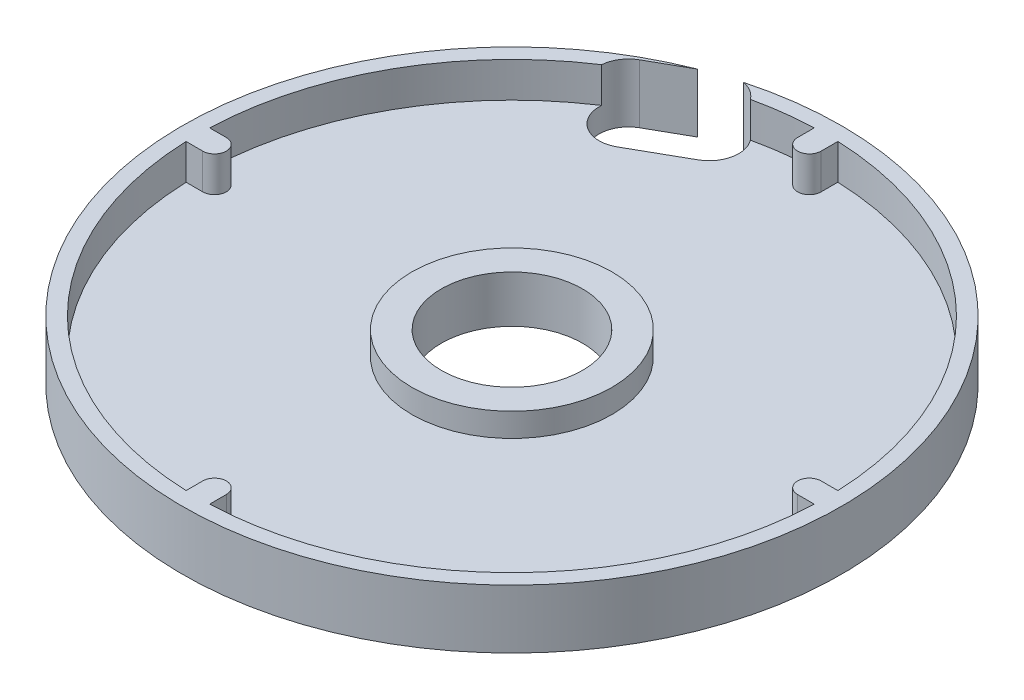
from build123d import *

# Parameters (mm, degrees)
SKETCH_1_R               = 28
EXTRUDE_1_DEPTH          = 2
SKETCH_2_R               = 28
SKETCH_2_R_2             = 26.7
EXTRUDE_3_DEPTH          = 3
EXTRUDE_4_DEPTH          = 3
PATTERN_CIRCULAR_1_COUNT = 4
CUT_EXTRUDE_1_DEPTH      = 5
SKETCH_5_R               = 8.5
SKETCH_5_R_2             = 6
EXTRUDE_5_DEPTH          = 2
SKETCH_6_R               = 6
CUT_EXTRUDE_2_DEPTH      = 2.5


with BuildPart() as part:
    # 草图1 → 凸台-拉伸1 (new body)
    with BuildSketch(Plane(origin=(0, 0, 0), x_dir=(1, 0, 0), z_dir=(0, 1, 0))):
        with Locations(Location((0, 0, 0), (0, 0, 270))):
            Circle(SKETCH_1_R)
    extrude(amount=EXTRUDE_1_DEPTH)

    # 草图2 → 凸台-拉伸3 (add)
    with BuildSketch(Plane(origin=(0, 2, 0), x_dir=(1, 0, 0), z_dir=(0, 1, 0))):
        with Locations(Location((0, 0, 0), (0, 0, 270))):
            Circle(SKETCH_2_R)
        with Locations(Location((0, 0, 0), (0, 0, 270))):
            Circle(SKETCH_2_R_2, mode=Mode.SUBTRACT)
    extrude(amount=EXTRUDE_3_DEPTH)

    # 草图3 → 凸台-拉伸4 (add)
    with BuildSketch(Plane(origin=(0, 2, 0), x_dir=(1, 0, 0), z_dir=(0, 1, 0))):
        with BuildLine():
            Line((1, 26.681266836), (1, 25.262759823))
            ThreePointArc((1, 25.262759823), (0, 24.262759823), (-1, 25.262759823))
            Line((-1, 25.262759823), (-1, 26.681266836))
            ThreePointArc((-1, 26.681266836), (0, 26.7), (1, 26.681266836))
        make_face()
    extrude_4 = extrude(amount=EXTRUDE_4_DEPTH)

    # 阵列(圆周)1: 凸台-拉伸4 ×4 about axis
    pattern_circular_1_axis = Axis((0, 0, 0), (0, 1, 0))
    for i in range(1, PATTERN_CIRCULAR_1_COUNT):
        add(extrude_4.rotate(pattern_circular_1_axis, i * 360 / PATTERN_CIRCULAR_1_COUNT))

    # 草图4 → 切除-拉伸1 (cut, symmetric)
    with BuildSketch(Plane(origin=(0, 2, 0), x_dir=(1, 0, 0), z_dir=(0, 1, 0))):
        with BuildLine():
            Line((-13.418233233, 24.2713603), (-9.042053051, 26.744853446))
            ThreePointArc((-9.042053051, 26.744853446), (-5.635502812, 25.798589491), (-6.581766767, 22.392039253))
            Line((-6.581766767, 22.392039253), (-10.957946949, 19.918546106))
            ThreePointArc((-10.957946949, 19.918546106), (-14.364497188, 20.864810061), (-13.418233233, 24.2713603))
        make_face()
    extrude(amount=CUT_EXTRUDE_1_DEPTH, both=True, mode=Mode.SUBTRACT)

    # 草图5 → 凸台-拉伸5 (add)
    with BuildSketch(Plane(origin=(0, 2, 0), x_dir=(1, 0, 0), z_dir=(0, 1, 0))):
        with Locations(Location((0, 0, 0), (0, 0, 270))):
            Circle(SKETCH_5_R)
        with Locations(Location((0, 0, 0), (0, 0, 270))):
            Circle(SKETCH_5_R_2, mode=Mode.SUBTRACT)
    extrude(amount=EXTRUDE_5_DEPTH)

    # 草图6 → 切除-拉伸2 (cut, symmetric)
    with BuildSketch(Plane(origin=(0, 2, 0), x_dir=(1, 0, 0), z_dir=(0, 1, 0))):
        with Locations(Location((0, 0, 0), (0, 0, 270))):
            Circle(SKETCH_6_R)
    extrude(amount=CUT_EXTRUDE_2_DEPTH, both=True, mode=Mode.SUBTRACT)


solid = part.part
